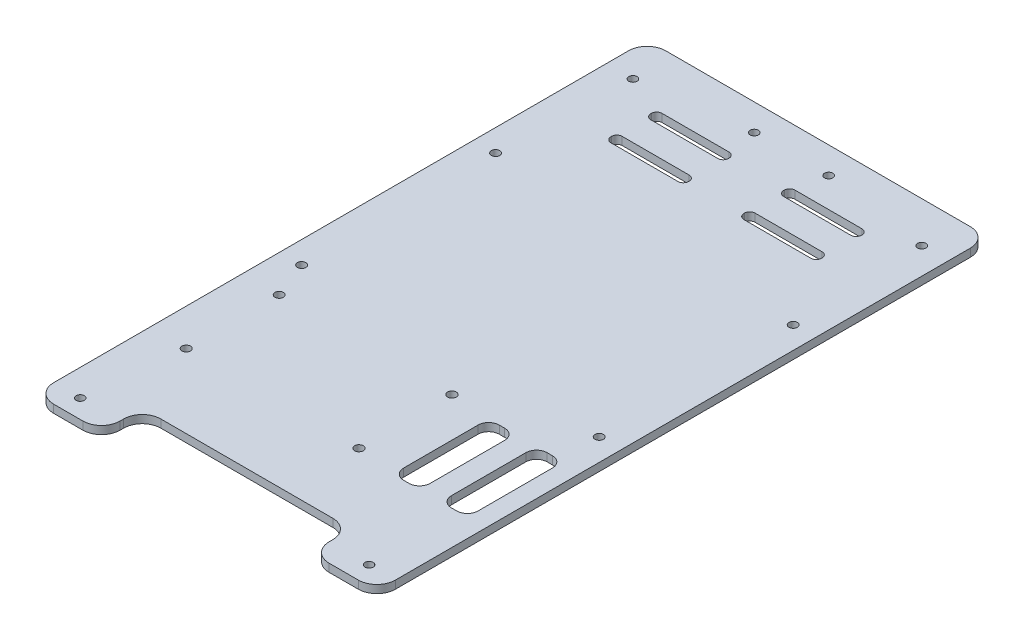
from build123d import *

# Parameters (mm, degrees)
SKETCH1_W           = 180
SKETCH1_H           = 240
BOSS_EXTRUDE1_DEPTH = 3
SKETCH3_R           = 1.55
CUT_EXTRUDE2_DEPTH  = 151.029997001
SKETCH4_R           = 1.6
SKETCH4_R_2         = 1.65
CUT_EXTRUDE3_DEPTH  = 151.029997001
SKETCH5_R           = 1.6
CUT_EXTRUDE4_DEPTH  = 151.029997001
SKETCH6_R           = 1.55
CUT_EXTRUDE5_DEPTH  = 151.029997001
SKETCH7_W           = 25.678556749
SKETCH7_H           = 240
SKETCH7_W_2         = 78.7
SKETCH7_H_2         = 25
CUT_EXTRUDE6_DEPTH  = 151.029997001
SKETCH8_W           = 128.642886502
SKETCH8_H           = 9.657988802
CUT_EXTRUDE7_DEPTH  = 137.184610224
FILLET1_R           = 7


with BuildPart() as part:
    # Sketch1 → Boss-Extrude1 (new body)
    with BuildSketch(Plane(origin=(0, 0, 0), x_dir=(1, 0, 0), z_dir=(0, 1, 0))):
        Rectangle(SKETCH1_W, SKETCH1_H)
    extrude(amount=BOSS_EXTRUDE1_DEPTH)

    # Sketch3 → Cut-Extrude2 (cut, through all)
    with BuildSketch(Plane(origin=(0, 3, 0), x_dir=(1, 0, 0), z_dir=(0, 1, 0))):
        with Locations(Location((14, 110, 0), (0, 0, 270))):
            Circle(SKETCH3_R)
        with Locations(Location((-14, 110, 0), (0, 0, 90))):
            Circle(SKETCH3_R)
    extrude(amount=-CUT_EXTRUDE2_DEPTH, mode=Mode.SUBTRACT)

    # Sketch4 → Cut-Extrude3 (cut, through all)
    with BuildSketch(Plane(origin=(0, 3, 0), x_dir=(1, 0, 0), z_dir=(0, 1, 0))):
        with Locations(Location((-50.5, -32.268683434, 0), (0, 0, 270))):
            Circle(SKETCH4_R)
        with Locations(Location((-50.5, -67.268683434, 0), (0, 0, 270))):
            Circle(SKETCH4_R)
        with Locations(Location((14.5, -32.268683434, 0), (0, 0, 270))):
            Circle(SKETCH4_R_2)
        with Locations(Location((14.5, -67.268683434, 0), (0, 0, 270))):
            Circle(SKETCH4_R_2)
    extrude(amount=-CUT_EXTRUDE3_DEPTH, mode=Mode.SUBTRACT)

    # Sketch5 → Cut-Extrude4 (cut, through all)
    with BuildSketch(Plane(origin=(0, 3, 0), x_dir=(1, 0, 0), z_dir=(0, 1, 0))):
        with Locations(Location((56, 54.660722259, 0), (0, 0, 270))):
            Circle(SKETCH5_R)
        with Locations(Location((56, -18.339277741, 0), (0, 0, 270))):
            Circle(SKETCH5_R)
        with Locations(Location((-56, -18.339277741, 0), (0, 0, 270))):
            Circle(SKETCH5_R)
        with Locations(Location((-56, 54.660722259, 0), (0, 0, 270))):
            Circle(SKETCH5_R)
    extrude(amount=-CUT_EXTRUDE4_DEPTH, mode=Mode.SUBTRACT)

    # Sketch6 → Cut-Extrude5 (cut, through all)
    with BuildSketch(Plane(origin=(0, 3, 0), x_dir=(1, 0, 0), z_dir=(0, 1, 0))):
        with Locations(Location((-54.321443251, -103.342011198, 0), (0, 0, 270))):
            Circle(SKETCH6_R)
        with Locations(Location((54.378556749, -103.342011198, 0), (0, 0, 270))):
            Circle(SKETCH6_R)
        with Locations(Location((-54.321443251, 104.657988802, 0), (0, 0, 270))):
            Circle(SKETCH6_R)
        with Locations(Location((54.378556749, 104.657988802, 0), (0, 0, 270))):
            Circle(SKETCH6_R)
    extrude(amount=-CUT_EXTRUDE5_DEPTH, mode=Mode.SUBTRACT)

    # Sketch7 → Cut-Extrude6 (cut, through all)
    with BuildSketch(Plane(origin=(0, 3, 0), x_dir=(1, 0, 0), z_dir=(0, 1, 0))):
        with BuildLine():
            Line((37.630016224, 79.701073582), (12.399273995, 79.701073582))
            ThreePointArc((12.399273995, 79.701073582), (10.985060433, 80.286860019), (10.399273995, 81.701073582))
            Line((10.399273995, 81.701073582), (10.399273995, 81.912178755))
            ThreePointArc((10.399273995, 81.912178755), (10.985060433, 83.326392317), (12.399273995, 83.912178755))
            Line((12.399273995, 83.912178755), (37.630016224, 83.912178755))
            ThreePointArc((37.630016224, 83.912178755), (39.044229786, 83.326392317), (39.630016224, 81.912178755))
            Line((39.630016224, 81.912178755), (39.630016224, 81.701073582))
            ThreePointArc((39.630016224, 81.701073582), (39.044229786, 80.286860019), (37.630016224, 79.701073582))
        make_face()
        with BuildLine():
            Line((-37.630016224, 83.912178755), (-12.399273995, 83.912178755))
            ThreePointArc((-12.399273995, 83.912178755), (-10.985060433, 83.326392317), (-10.399273995, 81.912178755))
            Line((-10.399273995, 81.912178755), (-10.399273995, 81.701073582))
            ThreePointArc((-10.399273995, 81.701073582), (-10.985060433, 80.286860019), (-12.399273995, 79.701073582))
            Line((-12.399273995, 79.701073582), (-37.630016224, 79.701073582))
            ThreePointArc((-37.630016224, 79.701073582), (-39.044229786, 80.286860019), (-39.630016224, 81.701073582))
            Line((-39.630016224, 81.701073582), (-39.630016224, 81.912178755))
            ThreePointArc((-39.630016224, 81.912178755), (-39.044229786, 83.326392317), (-37.630016224, 83.912178755))
        make_face()
        with Locations((-77.160721626, 0)):
            Rectangle(SKETCH7_W, SKETCH7_H)
        with Locations((0.028556749, -107.5)):
            Rectangle(SKETCH7_W_2, SKETCH7_H_2)
        with Locations((77.160721626, 0)):
            Rectangle(SKETCH7_W, SKETCH7_H)
        with BuildLine():
            Line((29.345445331, -37.30118784), (29.345445331, -65.30118784))
            ThreePointArc((29.345445331, -65.30118784), (30.517018206, -68.129614965), (33.345445331, -69.30118784))
            Line((33.345445331, -69.30118784), (35.345445331, -69.30118784))
            ThreePointArc((35.345445331, -69.30118784), (38.173872456, -68.129614965), (39.345445331, -65.30118784))
            Line((39.345445331, -65.30118784), (39.345445331, -37.30118784))
            ThreePointArc((39.345445331, -37.30118784), (38.173872456, -34.472760715), (35.345445331, -33.30118784))
            Line((35.345445331, -33.30118784), (33.345445331, -33.30118784))
            ThreePointArc((33.345445331, -33.30118784), (30.517018206, -34.472760715), (29.345445331, -37.30118784))
        make_face()
        with BuildLine():
            Line((51.345445331, -33.30118784), (53.345445331, -33.30118784))
            ThreePointArc((53.345445331, -33.30118784), (56.173872456, -34.472760715), (57.345445331, -37.30118784))
            Line((57.345445331, -37.30118784), (57.345445331, -65.30118784))
            ThreePointArc((57.345445331, -65.30118784), (56.173872456, -68.129614965), (53.345445331, -69.30118784))
            Line((53.345445331, -69.30118784), (51.345445331, -69.30118784))
            ThreePointArc((51.345445331, -69.30118784), (48.517018206, -68.129614965), (47.345445331, -65.30118784))
            Line((47.345445331, -65.30118784), (47.345445331, -37.30118784))
            ThreePointArc((47.345445331, -37.30118784), (48.517018206, -34.472760715), (51.345445331, -33.30118784))
        make_face()
        with BuildLine():
            Line((37.630016224, 94.701073582), (12.399273995, 94.701073582))
            ThreePointArc((12.399273995, 94.701073582), (10.985060433, 95.286860019), (10.399273995, 96.701073582))
            Line((10.399273995, 96.701073582), (10.399273995, 96.912178755))
            ThreePointArc((10.399273995, 96.912178755), (10.985060433, 98.326392317), (12.399273995, 98.912178755))
            Line((12.399273995, 98.912178755), (37.630016224, 98.912178755))
            ThreePointArc((37.630016224, 98.912178755), (39.044229786, 98.326392317), (39.630016224, 96.912178755))
            Line((39.630016224, 96.912178755), (39.630016224, 96.701073582))
            ThreePointArc((39.630016224, 96.701073582), (39.044229786, 95.286860019), (37.630016224, 94.701073582))
        make_face()
        with BuildLine():
            Line((-37.630016224, 98.912178755), (-12.399273995, 98.912178755))
            ThreePointArc((-12.399273995, 98.912178755), (-10.985060433, 98.326392317), (-10.399273995, 96.912178755))
            Line((-10.399273995, 96.912178755), (-10.399273995, 96.701073582))
            ThreePointArc((-10.399273995, 96.701073582), (-10.985060433, 95.286860019), (-12.399273995, 94.701073582))
            Line((-12.399273995, 94.701073582), (-37.630016224, 94.701073582))
            ThreePointArc((-37.630016224, 94.701073582), (-39.044229786, 95.286860019), (-39.630016224, 96.701073582))
            Line((-39.630016224, 96.701073582), (-39.630016224, 96.912178755))
            ThreePointArc((-39.630016224, 96.912178755), (-39.044229786, 98.326392317), (-37.630016224, 98.912178755))
        make_face()
    extrude(amount=-CUT_EXTRUDE6_DEPTH, mode=Mode.SUBTRACT)

    # Sketch8 → Cut-Extrude7 (cut, through all)
    with BuildSketch(Plane(origin=(0, 3, 0), x_dir=(1, 0, 0), z_dir=(0, 1, 0))):
        with Locations((0, -115.171005599)):
            Rectangle(SKETCH8_W, SKETCH8_H)
    extrude(amount=-CUT_EXTRUDE7_DEPTH, mode=Mode.SUBTRACT)

    # Fillet1
    fillet1_edges = [part.edges().sort_by_distance(p)[0] for p in [
        (-64.321443251, 1.5, -120),
        (-39.321443251, 1.5, 95),
        (39.378556749, 1.5, 95),
        (64.321443251, 1.5, -120),
        (39.378556749, 1.5, 110.342011198),
        (-39.321443251, 1.5, 110.342011198),
        (-64.321443251, 1.5, 110.342011198),
        (64.321443251, 1.5, 110.342011198),
    ]]
    fillet(fillet1_edges, radius=FILLET1_R)


solid = part.part
